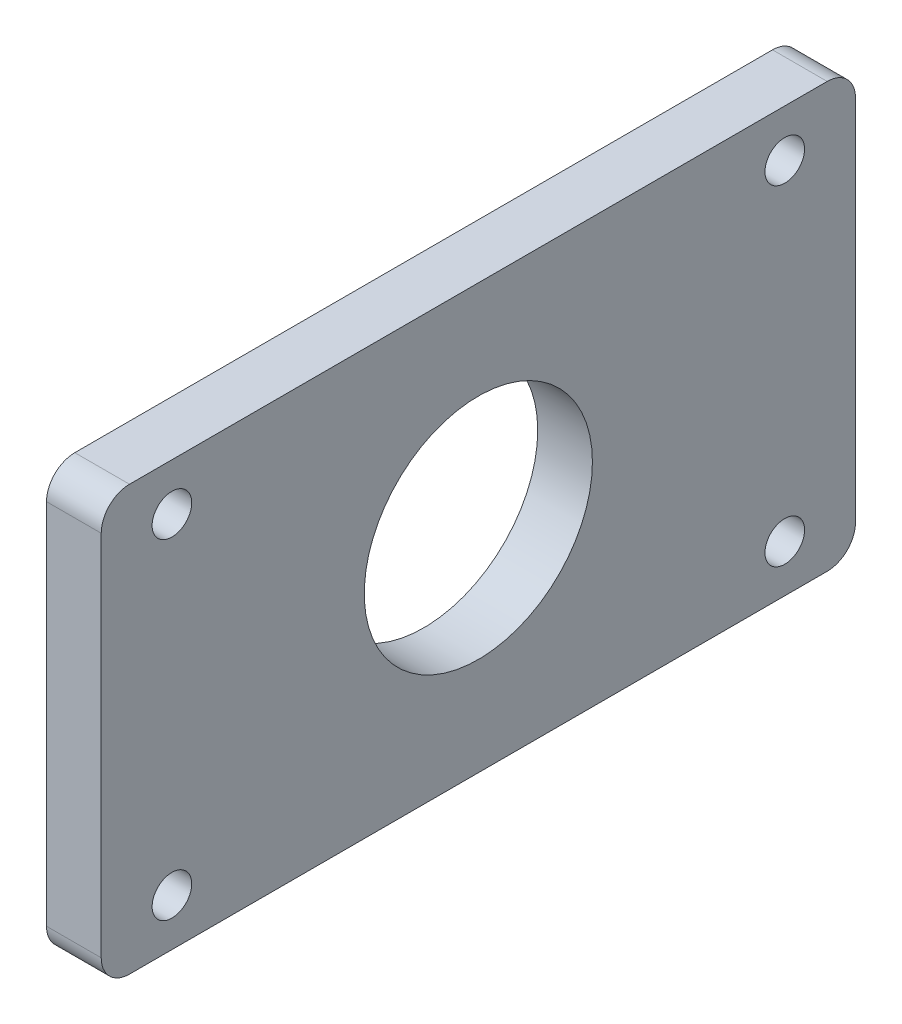
from build123d import *

# Parameters (mm, degrees)
SKETCH_1_W      = 80
SKETCH_1_H      = 45
SKETCH_1_R      = 12.1
SKETCH_1_R_2    = 2.1
EXTRUDE_1_DEPTH = 5.8
FILLET_1_R      = 3


with BuildPart() as part:
    # ｽｹｯﾁ1 → ﾎﾞｽ - 押し出し1 (new body)
    with BuildSketch(Plane(origin=(0, 0, 0), x_dir=(0, 0, -1), z_dir=(1, 0, 0))):
        Rectangle(SKETCH_1_W, SKETCH_1_H)
        Circle(SKETCH_1_R, mode=Mode.SUBTRACT)
        with Locations((32.5, 17.5)):
            Circle(SKETCH_1_R_2, mode=Mode.SUBTRACT)
        with Locations(Location((32.5, -17.5, 0), (0, 0, 180))):
            Circle(SKETCH_1_R_2, mode=Mode.SUBTRACT)
        with Locations(Location((-32.5, 17.5, 0), (0, 0, 180))):
            Circle(SKETCH_1_R_2, mode=Mode.SUBTRACT)
        with Locations((-32.5, -17.5)):
            Circle(SKETCH_1_R_2, mode=Mode.SUBTRACT)
    extrude(amount=EXTRUDE_1_DEPTH)

    # ﾌｨﾚｯﾄ1
    fillet_1_edges = [part.edges().sort_by_distance(p)[0] for p in [
        (2.9, -22.5, -40),
        (2.9, -22.5, 40),
        (2.9, 22.5, 40),
        (2.9, 22.5, -40),
    ]]
    fillet(fillet_1_edges, radius=FILLET_1_R)


solid = part.part
